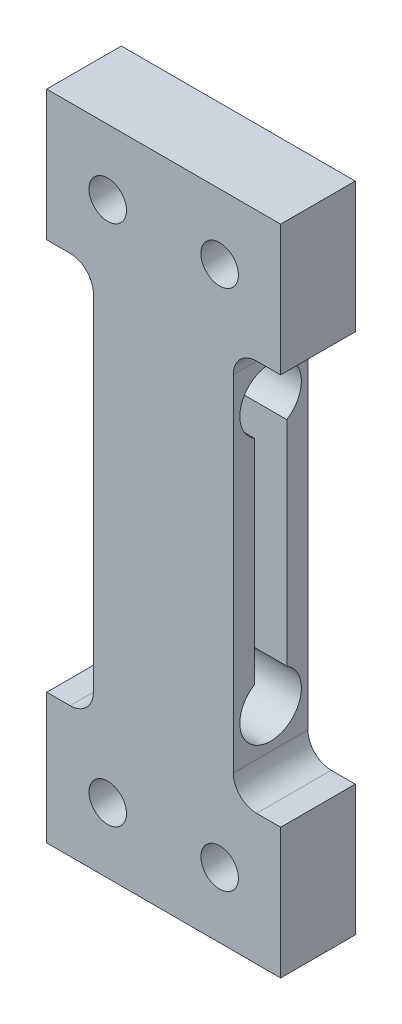
from build123d import *

# Parameters (mm, degrees)
SKETCH1_W           = 12.538434267
SKETCH1_H           = 35
BOSS_EXTRUDE1_DEPTH = 4
SKETCH2_W           = 2.538434267
SKETCH2_H           = 21
CUT_EXTRUDE1_DEPTH  = 37.619666847
SKETCH3_W           = 2.5
SKETCH3_H           = 21
CUT_EXTRUDE2_DEPTH  = 37.619666847
CUT_EXTRUDE3_DEPTH  = 37.619666847
SKETCH5_W           = 7.5
SKETCH5_H           = 1.65
SKETCH6_W           = 7.5
SKETCH6_H           = 1.65
HOLE1_D             = 2.013
FILLET1_R           = 1.25


with BuildPart() as part:
    # Sketch1 → Boss-Extrude1 (new body)
    with BuildSketch(Plane(origin=(0, 0, 0), x_dir=(-1, 0, 0), z_dir=(0, 0, -1))):
        with Locations((3.730782867, 17.5)):
            Rectangle(SKETCH1_W, SKETCH1_H)
    extrude(amount=-BOSS_EXTRUDE1_DEPTH)

    # Sketch2 → Cut-Extrude1 (cut, through all)
    with BuildSketch(Plane.XY.offset(4)):
        with Locations((1.269217133, 17.5)):
            Rectangle(SKETCH2_W, SKETCH2_H)
    extrude(amount=-CUT_EXTRUDE1_DEPTH, mode=Mode.SUBTRACT)

    # Sketch3 → Cut-Extrude2 (cut, through all)
    with BuildSketch(Plane.XY.offset(4)):
        with Locations((-8.75, 17.5)):
            Rectangle(SKETCH3_W, SKETCH3_H)
    extrude(amount=-CUT_EXTRUDE2_DEPTH, mode=Mode.SUBTRACT)

    # Sketch4 → Cut-Extrude3 (cut, through all)
    with BuildSketch(Plane(origin=(0, 0, 0), x_dir=(0, 0, -1), z_dir=(1, 0, 0))):
        with BuildLine():
            Line((-2.855933763, 23.21436986), (-2.855933763, 11.78563014))
            ThreePointArc((-2.855933763, 11.78563014), (-1.992824856, 12.024984399), (-1.13183027, 11.778132681))
            Line((-1.13183027, 11.778132681), (-1.13183027, 23.221867319))
            ThreePointArc((-1.13183027, 23.221867319), (-1.992824856, 22.975015601), (-2.855933763, 23.21436986))
        make_face()
    extrude(amount=-CUT_EXTRUDE3_DEPTH, mode=Mode.SUBTRACT)

    # Sketch5 → Cut-Revolve1 (revolve, cut)
    with BuildSketch(Plane.XY.offset(2)):
        with Locations((-3.75, 11.2)):
            Rectangle(SKETCH5_W, SKETCH5_H)
    revolve(axis=Axis((-7.5, 10.375, 2), (1, 0, 0)), mode=Mode.SUBTRACT)

    # Sketch6 → Cut-Revolve2 (revolve, cut)
    with BuildSketch(Plane.XY.offset(2)):
        with Locations((-3.75, 25.45)):
            Rectangle(SKETCH6_W, SKETCH6_H)
    revolve(axis=Axis((-7.5, 24.625, 2), (1, 0, 0)), mode=Mode.SUBTRACT)

    # Hole1 (through all)
    with Locations(Plane(origin=(0, 0, 0), x_dir=(-1, 0, 0), z_dir=(0, 0, -1))):
        with Locations((0.730782866, 3.5), (6.730782866, 3.5), (0.730782866, 31.5), (6.730782866, 31.5)):
            Hole(HOLE1_D / 2)

    # Fillet1
    fillet1_edges = [part.edges().sort_by_distance(p)[0] for p in [
        (0, 7, 2),
        (0, 28, 2),
        (-7.5, 28, 2),
        (-7.5, 7, 2),
    ]]
    fillet(fillet1_edges, radius=FILLET1_R)


solid = part.part
